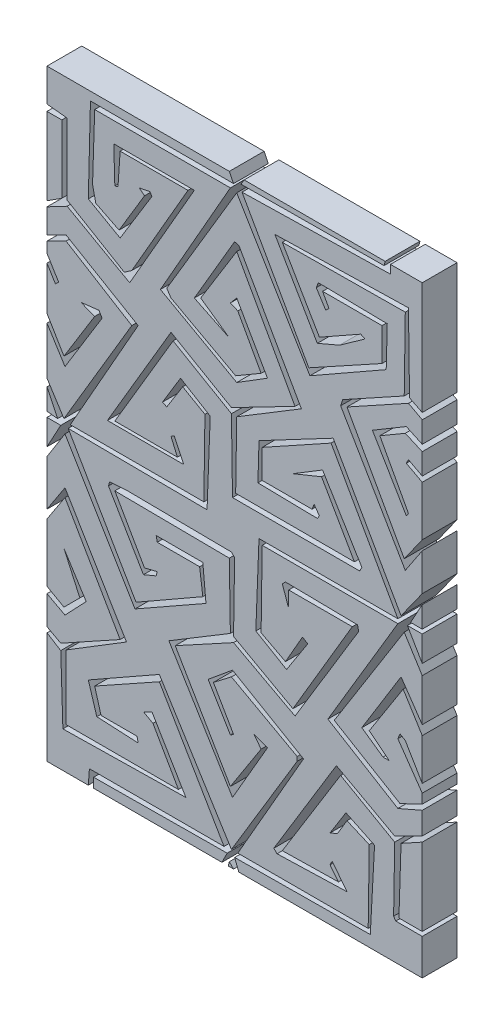
from build123d import *

# Parameters (mm, degrees)
BOSS_EXTRUDE1_DEPTH    = 3
BOSS_EXTRUDE1_2_DEPTH  = 3
BOSS_EXTRUDE1_3_DEPTH  = 3
BOSS_EXTRUDE1_4_DEPTH  = 3
BOSS_EXTRUDE1_5_DEPTH  = 3
BOSS_EXTRUDE1_6_DEPTH  = 3
BOSS_EXTRUDE1_7_DEPTH  = 3
BOSS_EXTRUDE1_8_DEPTH  = 3
BOSS_EXTRUDE1_9_DEPTH  = 3
BOSS_EXTRUDE1_10_DEPTH = 3
BOSS_EXTRUDE1_11_DEPTH = 3
BOSS_EXTRUDE1_12_DEPTH = 3
BOSS_EXTRUDE1_13_DEPTH = 3
BOSS_EXTRUDE1_14_DEPTH = 3


with BuildPart() as part:
    # Sketch1 → Boss-Extrude1 (new body)
    with BuildSketch(Plane.XY):
        Polygon((13.927502639, -25.281708745), (13.836056423, -25.647493611), (14.293287506, -25.647493611), align=None)
    extrude(amount=BOSS_EXTRUDE1_DEPTH)


with BuildPart() as body_2:
    # Sketch1 → Boss-Extrude1 2 (new body)
    with BuildSketch(Plane.XY):
        Polygon((2.222386919, -25.647493611), (13.287379123, -25.647493611), (13.744610206, -24.733031445), (2.222386919, -24.824477662), align=None)
    extrude(amount=BOSS_EXTRUDE1_2_DEPTH)


with BuildPart() as body_3:
    # Sketch1 → Boss-Extrude1 3 (new body)
    with BuildSketch(Plane.XY):
        Polygon((30.570714054, -15.496963572), (28.741789723, -16.502871954), (28.55889729, -22.172537381), (30.570714054, -22.172537381), align=None)
    extrude(amount=BOSS_EXTRUDE1_3_DEPTH)


with BuildPart() as body_4:
    # Sketch1 → Boss-Extrude1 4 (new body)
    with BuildSketch(Plane.XY):
        Polygon((-0.246660928, -5.1635411), (-1.80124661, -7.541142731), (-1.80124661, -12.570684642), (-0.338107145, -13.393700591), (1.033586104, -12.022007343), (-0.338107145, -9.004282196), (1.582263403, -12.022007343), (-0.246660928, -13.942377891), (-1.80124661, -13.119361942), (-1.80124661, -15.588409789), (-0.612445794, -16.228533305), (4.508542333, -13.393700591), align=None)
    extrude(amount=BOSS_EXTRUDE1_4_DEPTH)


with BuildPart() as body_5:
    # Sketch1 → Boss-Extrude1 5 (new body)
    with BuildSketch(Plane.XY):
        Polygon((29.016128373, -0.591230272), (22.980678079, -10.193083011), (28.650343506, -13.576593024), (30.570714054, -12.662130859), (30.570714054, -11.83911491), (28.467451073, -8.821389763), (28.650343506, -8.36415868), (29.107574589, -8.63849733), (30.570714054, -11.107545177), (30.570714054, -7.541142731), (28.924682156, -4.889202451), (25.998403226, -9.461513279), (27.735881341, -10.833206527), (27.187204041, -10.833206527), (25.35827971, -9.552959496), (28.741789723, -4.066186502), (30.570714054, -6.718126782), (30.570714054, -3.060278119), align=None)
    extrude(amount=BOSS_EXTRUDE1_5_DEPTH)


with BuildPart() as body_6:
    # Sketch1 → Boss-Extrude1 6 (new body)
    with BuildSketch(Plane.XY):
        Polygon((29.290467022, 0.048893244), (30.570714054, -2.145815954), (30.570714054, 0.048893244), align=None)
    extrude(amount=BOSS_EXTRUDE1_6_DEPTH)


with BuildPart() as body_7:
    # Sketch1 → Boss-Extrude1 7 (new body)
    with BuildSketch(Plane.XY):
        Polygon((-0.612445794, 0.048893244), (-1.80124661, 0.048893244), (-1.80124661, -2.145815954), align=None)
    extrude(amount=BOSS_EXTRUDE1_7_DEPTH)


with BuildPart() as body_8:
    # Sketch1 → Boss-Extrude1 8 (new body)
    with BuildSketch(Plane.XY):
        Polygon((30.570714054, 2.243602441), (29.564805672, 0.41467811), (30.570714054, 0.41467811), align=None)
    extrude(amount=BOSS_EXTRUDE1_8_DEPTH)


with BuildPart() as body_9:
    # Sketch1 → Boss-Extrude1 9 (new body)
    with BuildSketch(Plane.XY):
        Polygon((-1.80124661, 2.335048658), (-1.80124661, 0.506124327), (-0.886784444, 0.41467811), align=None)
    extrude(amount=BOSS_EXTRUDE1_9_DEPTH)


with BuildPart() as body_10:
    # Sketch1 → Boss-Extrude1 10 (new body)
    with BuildSketch(Plane.XY):
        Polygon((-0.155214712, 14.040164378), (-1.80124661, 13.217148429), (-1.80124661, 12.302686263), (-0.795338228, 10.656654365), (-1.069676877, 10.382315716), (-1.80124661, 11.571116531), (-1.80124661, 7.821821652), (-0.338107145, 5.352773805), (2.313833136, 9.650745983), (1.12503232, 10.107977066), (2.679618002, 10.290869499), (2.953956652, 9.833638416), (-0.246660928, 4.621204072), (-1.80124661, 7.090251919), (-1.80124661, 2.975172174), (-0.338107145, 0.68901676), (5.514450715, 10.565208149), align=None)
    extrude(amount=BOSS_EXTRUDE1_10_DEPTH)


with BuildPart() as body_11:
    # Sketch1 → Boss-Extrude1 11 (new body)
    with BuildSketch(Plane.XY):
        Polygon((29.381913239, 16.692104659), (24.078032678, 13.765825729), (29.016128373, 4.895542722), (30.570714054, 7.090251919), (30.570714054, 11.388224098), (29.199020806, 12.11979383), (29.381913239, 12.485578697), (30.570714054, 11.845455181), (30.570714054, 13.674379512), (29.107574589, 14.314503028), (26.912865392, 13.034255996), (29.381913239, 8.461945168), (29.199020806, 8.187606518), (26.272741876, 13.125702213), (29.199020806, 14.863180327), (30.570714054, 14.223056811), (30.570714054, 16.051981143), align=None)
    extrude(amount=BOSS_EXTRUDE1_11_DEPTH)


with BuildPart() as body_12:
    # Sketch1 → Boss-Extrude1 12 (new body)
    with BuildSketch(Plane.XY):
        Polygon((-0.520999578, 22.910447385), (-1.80124661, 22.910447385), (-1.80124661, 16.234873576), (-0.520999578, 17.057889525), align=None)
    extrude(amount=BOSS_EXTRUDE1_12_DEPTH)


with BuildPart() as body_13:
    # Sketch1 → Boss-Extrude1 13 (new body)
    with BuildSketch(Plane.XY):
        Polygon((14.933411022, 25.836726315), (27.278650258, 25.928172532), (27.370096474, 26.293957398), (15.207749671, 26.293957398), align=None)
    extrude(amount=BOSS_EXTRUDE1_13_DEPTH)


with BuildPart() as body_14:
    # Sketch1 → Boss-Extrude1 14 (new body)
    with BuildSketch(Plane.XY):
        Polygon((-1.80124661, 26.293957398), (-1.80124661, 23.459124684), (-0.063768495, 23.276232251), (-0.063768495, 17.149335741), (4.874327199, 14.223056811), (5.514450715, 14.680287894), (10.361100193, 23.093339818), (4.508542333, 23.093339818), (4.3256499, 20.349953321), (4.05131125, 20.258507105), (3.959865034, 23.367678468), (10.909777493, 23.367678468), (5.331558282, 13.674379512), (-0.063768495, 16.692104659), (-1.80124661, 15.777642493), (-1.80124661, 13.674379512), (-0.155214712, 14.497395461), (6.063128015, 10.839546798), (0.210570155, 0.506124327), (11.732793442, 0.506124327), (11.824239658, 7.090251919), (9.903869111, 8.187606518), (8.532175862, 5.99289732), (8.166390996, 6.175789754), (9.720976677, 8.736283817), (12.281470741, 7.181698136), (12.007132092, 0.048893244), (0.027677722, 0.14033946), (5.880235582, -9.918744362), (11.641347225, -6.626680565), (11.367008576, -4.523417584), (7.709159913, -4.523417584), (7.617713696, -4.066186502), (11.641347225, -4.066186502), (11.915685875, -6.992465432), (5.788789365, -10.467421661), (-0.246660928, -0.408337839), (-1.80124661, -2.877385686), (-1.80124661, -6.809572999), (-0.246660928, -4.431971368), (5.057219633, -13.302254375), (-0.155214712, -16.502871954), (-0.155214712, -22.081091165), (9.538084244, -22.081091165), (7.343375047, -18.240350069), (6.520359098, -17.783118986), (7.25192883, -17.41733412), (10.17820776, -22.355429815), (-0.429553361, -22.538322248), (-0.612445794, -16.777210604), (-1.80124661, -16.045640872), (-1.80124661, -25.647493611), (1.765155836, -25.647493611), (1.856602053, -24.367246579), (13.470271557, -24.367246579), (7.892052346, -14.856840056), (2.313833136, -17.966011419), (2.862510435, -19.886381967), (5.971681798, -19.886381967), (6.063128015, -20.34361305), (2.496725569, -20.160720617), (1.765155836, -17.783118986), (7.892052346, -14.308162757), (14.110395073, -24.275800362), (19.7800605, -14.856840056), (19.7800605, -14.49105519), (14.110395073, -11.381883827), (12.555809391, -12.570684642), (14.293287506, -15.588409789), (14.018948856, -15.771302222), (12.098578308, -12.570684642), (14.201841289, -10.833206527), (20.328737799, -14.399608973), (14.659072372, -24.275800362), (25.906957009, -24.275800362), (25.998403226, -17.966011419), (24.078032678, -17.14299547), (23.255016729, -18.514688719), (22.614893213, -18.789027369), (23.986586462, -16.594318171), (26.455634309, -17.783118986), (26.089849443, -24.641585229), (14.384733722, -24.733031445), (14.750518588, -25.647493611), (30.570714054, -25.647493611), (30.570714054, -22.538322248), (28.28455864, -22.538322248), (28.101666207, -22.263983598), (28.193112423, -16.685764388), (23.529355379, -14.033824107), (18.499813468, -22.172537381), (23.346462946, -22.081091165), (22.614893213, -21.166628999), (22.797785646, -20.800844133), (24.078032678, -22.446876031), (18.042582385, -22.629768464), (17.768243735, -22.355429815), (23.163570512, -13.485146808), (28.193112423, -16.228533305), (30.570714054, -15.039732489), (30.570714054, -13.119361942), (28.467451073, -14.033824107), (22.43200078, -10.375975445), (28.467451073, -0.225445406), (16.762335353, -0.225445406), (16.670889136, -6.809572999), (18.774152117, -7.906927597), (20.237291582, -5.346433534), (20.694522665, -5.620772183), (18.865598334, -8.455604897), (16.213658054, -6.901019215), (16.487996703, 0.14033946), (28.467451073, 0.14033946), (22.70633943, 10.382315716), (16.762335353, 7.090251919), (16.762335353, 4.621204072), (21.060307531, 4.621204072), (21.243199965, 5.078435155), (21.700431047, 4.438311639), (21.517538614, 4.163972989), (16.396550487, 4.255419206), (16.487996703, 7.456036786), (22.889231863, 10.839546798), (28.741789723, 0.506124327), (30.570714054, 3.06661839), (30.570714054, 6.26723597), (29.107574589, 4.072526773), (23.529355379, 13.582933295), (23.712247812, 14.131610595), (29.016128373, 17.057889525), (29.107574589, 23.367678468), (18.499813468, 23.276232251), (21.700431047, 17.789459257), (25.266833493, 19.801276022), (25.63261836, 19.618383589), (23.437909162, 18.063797907), (21.517538614, 17.240781958), (17.859689952, 23.550570901), (29.381913239, 23.824909551), (29.473359455, 17.149335741), (30.570714054, 16.600658442), (30.570714054, 26.293957398), (27.827327557, 26.293957398), (27.827327557, 25.562387665), (15.024857238, 25.288049016), (20.785968882, 15.04607276), (27.095757825, 18.52102899), (27.095757825, 21.355861703), (21.974769697, 21.355861703), (22.523446996, 20.349953321), (22.249108347, 20.075614671), (21.426092398, 21.355861703), (21.608984831, 21.813092786), (27.552988908, 21.72164657), (27.461542691, 18.24669034), (20.877415098, 14.497395461), (14.567626155, 25.013710366), (8.532175862, 14.863180327), (8.897960728, 14.314503028), (14.476179939, 11.296777881), (16.670889136, 12.577024913), (14.659072372, 16.234873576), (14.018948856, 16.509212225), (14.567626155, 17.149335741), (17.219566436, 12.485578697), (14.567626155, 10.839546798), (7.983498563, 14.497395461), (14.018948856, 25.105156583), (2.313833136, 25.105156583), (2.130940703, 19.435491156), (2.405279352, 18.155244124), (4.417096117, 17.149335741), (6.611805314, 20.807184404), (6.154574231, 21.17296927), (7.069036397, 21.355861703), (7.25192883, 21.081523054), (4.508542333, 16.600658442), (1.765155836, 18.155244124), (1.948048269, 25.562387665), (14.293287506, 25.562387665), (13.927502639, 26.293957398), align=None)
        Polygon((24.992494844, -2.054369737), (25.08394106, -2.51160082), (19.597168066, -11.56477626), (14.293287506, -8.729943546), (9.263745595, -11.473330043), (14.018948856, -19.612043318), (16.670889136, -15.496963572), (16.03076562, -14.673947623), (17.219566436, -15.131178706), (14.201841289, -20.34361305), (8.715068295, -11.381883827), (14.018948856, -8.181266247), (13.927502639, -2.603047037), (4.05131125, -2.51160082), (6.611805314, -6.992465432), (7.709159913, -6.718126782), (7.617713696, -7.083911648), (6.520359098, -7.541142731), (3.502633951, -2.420154603), (3.594080168, -2.054369737), (5.148665849, -1.962923521), (14.110395073, -2.054369737), (14.384733722, -2.328708387), (14.293287506, -8.272712464), (19.414275633, -11.107545177), (24.535263761, -2.420154603), (19.048490767, -2.420154603), (19.048490767, -3.791847852), (18.499813468, -2.23726217), (18.774152117, -1.962923521), align=None, mode=Mode.SUBTRACT)
        Polygon((14.384733722, 21.264415487), (14.750518588, 21.17296927), (20.145845366, 11.662562748), (14.567626155, 8.279052735), (14.476179939, 2.517941091), (24.718156194, 2.517941091), (21.883323481, 7.456036786), (19.414275633, 6.450128403), (21.974769697, 8.004714085), (25.35827971, 2.426494874), (25.175387277, 2.060710008), (14.201841289, 2.060710008), (14.110395073, 8.279052735), (9.080853161, 11.205331665), (4.05131125, 2.700833524), (9.446638028, 2.700833524), (8.897960728, 3.981080556), (9.172299378, 4.163972989), (9.995315327, 2.426494874), (3.411187734, 2.426494874), (8.897960728, 11.754008964), (14.110395073, 8.736283817), (19.597168066, 11.571116531), (14.567626155, 20.624291971), (11.458454792, 15.59475006), (13.927502639, 13.857271945), (10.909777493, 15.32041141), align=None, mode=Mode.SUBTRACT)
    extrude(amount=BOSS_EXTRUDE1_14_DEPTH)


solid = Compound([part.part, body_2.part, body_3.part, body_4.part, body_5.part, body_6.part, body_7.part, body_8.part, body_9.part, body_10.part, body_11.part, body_12.part, body_13.part, body_14.part])
